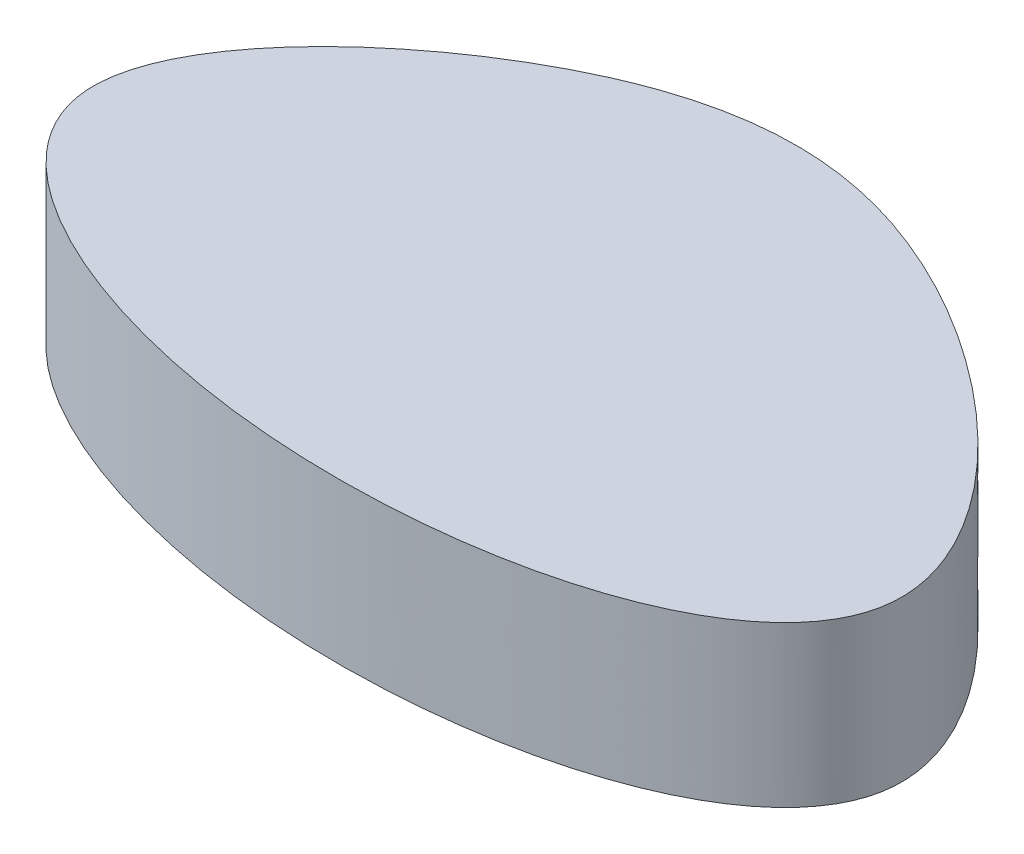
from build123d import *

# Parameters (mm, degrees)
BOSS_EXTRUDE1_DEPTH = 46.736


with BuildPart() as part:
    # Sketch1 → Boss-Extrude1 (new body)
    with BuildSketch(Plane(origin=(0, 0, 0), x_dir=(1, 0, 0), z_dir=(0, 1, 0))):
        with BuildLine():
            add(Edge.make_bspline(
                [(-54.340215738, 54.079090059), (-29.224344968, 65.252484615), (38.657121654, 71.144295096), (186.192424521, -60.858968332), (-20.38180385, -107.945223122), (-167.752840572, -31.683689546), (-90.54669776, 37.971772387), (-54.340215738, 54.079090059)],
                knots=[0, 0, 0, 0, 0.126641113, 0.360322874, 0.636919117, 0.817436981, 1, 1, 1, 1], degree=3))
        make_face()
    extrude(amount=BOSS_EXTRUDE1_DEPTH)


solid = part.part
